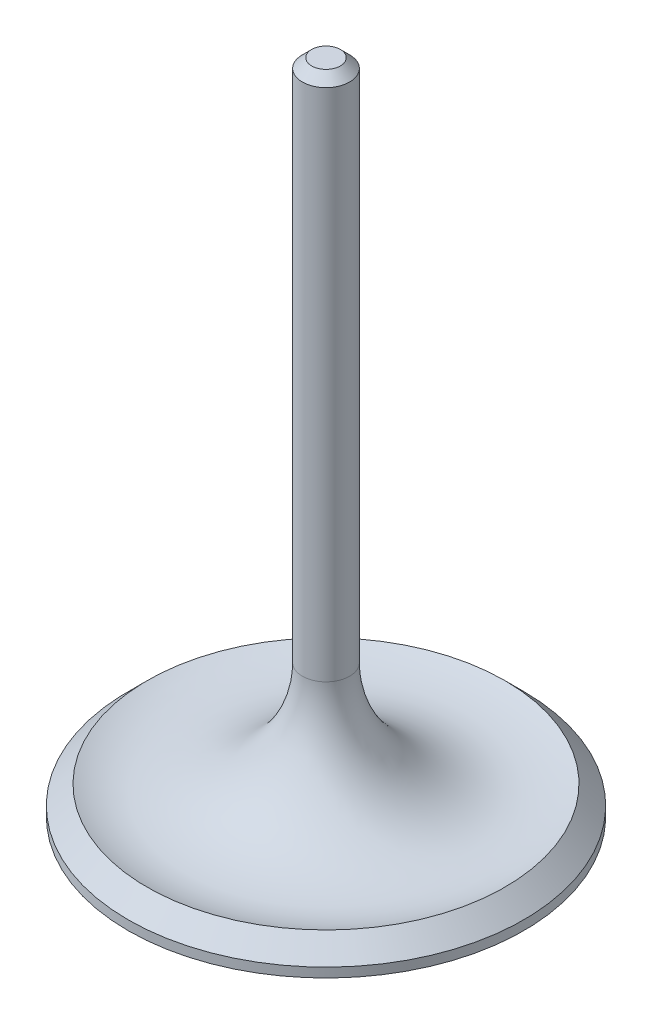
from build123d import *

# Parameters (mm, degrees)
CHAMFER1_SIZE = 1.25


with BuildPart() as part:
    # Sketch1 → Revolve1 (revolve)
    with BuildSketch(Plane(origin=(0, 0, 0), x_dir=(0, 0, -1), z_dir=(1, 0, 0))):
        with BuildLine():
            Line((0, 0), (0, 88.55))
            Line((0, 88.55), (3.18, 88.55))
            Line((3.18, 88.55), (3.18, 17.962741784))
            ThreePointArc((3.18, 17.962741784), (9.887678887, 5.329798738), (24.11, 3.81))
            Line((24.11, 3.81), (26.65, 1.27))
            Line((26.65, 1.27), (26.65, 0))
            Line((26.65, 0), (0, 0))
        make_face()
    revolve(axis=Axis((0, 0, 0), (0, 1, 0)))

    # Chamfer1
    chamfer1_edges = [part.edges().sort_by_distance(p)[0] for p in [
        (0, 88.55, 3.18),
    ]]
    chamfer(chamfer1_edges, length=CHAMFER1_SIZE)


solid = part.part
